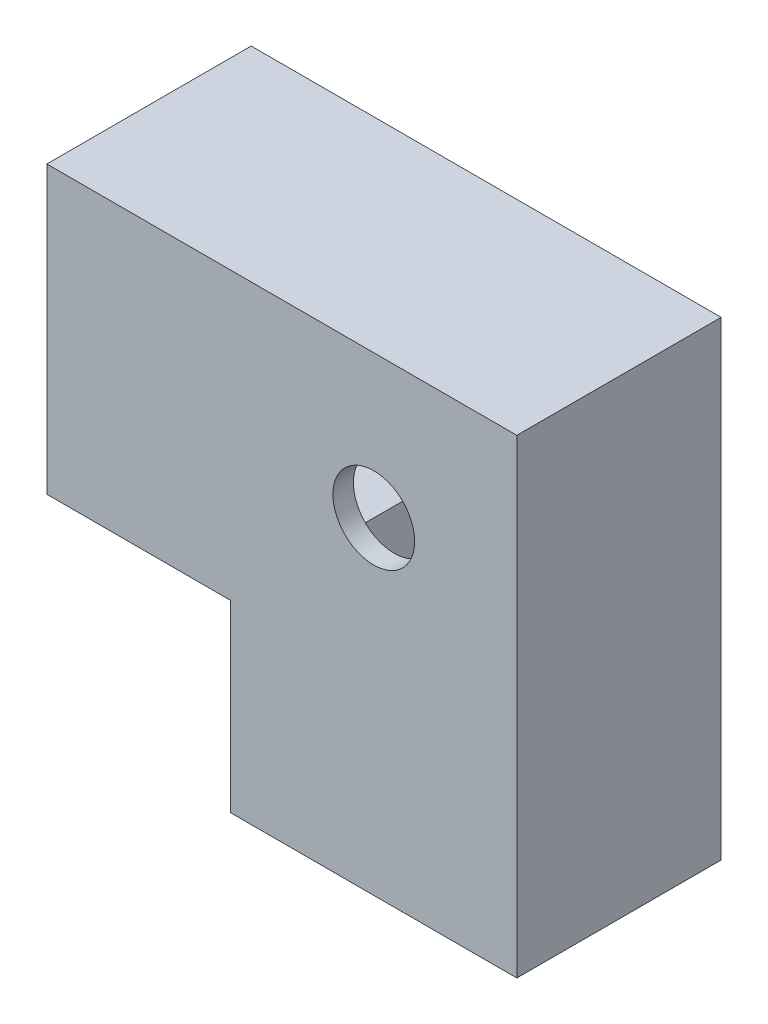
from build123d import *

# Parameters (mm, degrees)
CROQUIS1_R                   = 2000
SALIENTE_EXTRUIR1_DEPTH      = 1000
SALIENTE_EXTRUIR2_DEPTH      = 10000
SALIENTE_EXTRUIR3_DEPTH      = 500
SALIENTE_EXTRUIR3_DEPTH_BACK = 500
SALIENTE_EXTRUIR5_DEPTH      = 500
SALIENTE_EXTRUIR5_DEPTH_BACK = 500


with BuildPart() as part:
    # Croquis1 → Saliente-Extruir1 (new body)
    with BuildSketch(Plane.XY):
        Polygon((117743.416897498, 161337.836627923), (117743.416897498, 152337.836627923), (131743.416897498, 152337.836627923), (131743.416897498, 175337.836627923), (108743.416897498, 175337.836627923), (108743.416897498, 161337.836627923), align=None)
        with Locations((124743.416897498, 168337.836627923)):
            Circle(CROQUIS1_R, mode=Mode.SUBTRACT)
    extrude(amount=-SALIENTE_EXTRUIR1_DEPTH)

    # Croquis1<6> → Saliente-Extruir2 (add)
    with BuildSketch(Plane.XY):
        Polygon((117743.416897498, 161337.836627923), (117743.416897498, 152337.836627923), (118743.416897498, 152337.836627923), (118743.416897498, 162337.836627923), (108743.416897498, 162337.836627923), (108743.416897498, 161337.836627923), align=None)
        with BuildLine():
            Line((130743.416897498, 152337.836627923), (131743.416897498, 152337.836627923))
            Line((131743.416897498, 152337.836627923), (131743.416897498, 175337.836627923))
            Line((131743.416897498, 175337.836627923), (108743.416897498, 175337.836627923))
            Line((108743.416897498, 175337.836627923), (108743.416897498, 174337.836627923))
            Line((108743.416897498, 174337.836627923), (122843.416897498, 174337.836627923))
            Line((122843.416897498, 174337.836627923), (122843.416897498, 172837.836627923))
            ThreePointArc((122843.416897498, 172837.836627923), (123253.467403837, 171847.887134262), (124243.416897498, 171437.836627923))
            Line((124243.416897498, 171437.836627923), (125243.416897498, 171437.836627923))
            ThreePointArc((125243.416897498, 171437.836627923), (126233.366391159, 171847.887134262), (126643.416897498, 172837.836627923))
            Line((126643.416897498, 172837.836627923), (126643.416897498, 174337.836627923))
            Line((126643.416897498, 174337.836627923), (130743.416897498, 174337.836627923))
            Line((130743.416897498, 174337.836627923), (130743.416897498, 170237.836627923))
            Line((130743.416897498, 170237.836627923), (129243.416897498, 170237.836627923))
            ThreePointArc((129243.416897498, 170237.836627923), (128253.467403837, 169827.786121585), (127843.416897498, 168837.836627923))
            Line((127843.416897498, 168837.836627923), (127843.416897498, 167837.836627923))
            ThreePointArc((127843.416897498, 167837.836627923), (128253.467403837, 166847.887134262), (129243.416897498, 166437.836627923))
            Line((129243.416897498, 166437.836627923), (130743.416897498, 166437.836627923))
            Line((130743.416897498, 166437.836627923), (130743.416897498, 152337.836627923))
        make_face()
    extrude(amount=-SALIENTE_EXTRUIR2_DEPTH)

    # Croquis2 → Saliente-Extruir3 (add, two sides: drawn at the far end of the back side and taken through both)
    with BuildSketch(Plane(origin=(0, 156837.836627923, 0), x_dir=(1, 0, 0), z_dir=(0, 1, 0)).offset(-SALIENTE_EXTRUIR3_DEPTH_BACK)):
        with BuildLine():
            add(Edge.make_bspline(
                [(118743.416897498, 8000), (120739.811138244, 7120.578794783), (120743.416897498, 1000)],
                knots=[0, 0, 0, 0.514460755, 0.514460755, 0.514460755], degree=2))
            Line((118743.416897498, 8000), (118743.416897498, 1000))
            Line((118743.416897498, 1000), (120743.416897498, 1000))
        make_face()
        with BuildLine():
            Line((130743.416897498, 1000), (130743.416897498, 8000))
            add(Edge.make_bspline(
                [(130743.416897498, 8000), (128761.675222051, 7234.348262256), (128743.416897498, 1000)],
                knots=[0, 0, 0, 0.590989184, 0.590989184, 0.590989184], degree=2))
            Line((128743.416897498, 1000), (130743.416897498, 1000))
        make_face()
    extrude(amount=SALIENTE_EXTRUIR3_DEPTH + SALIENTE_EXTRUIR3_DEPTH_BACK)

    # Croquis4 → Saliente-Extruir5 (add, two sides: drawn at the far end of the back side and taken through both)
    with BuildSketch(Plane(origin=(113243.416897498, 0, 0), x_dir=(0, 0, -1), z_dir=(1, 0, 0)).offset(-SALIENTE_EXTRUIR5_DEPTH_BACK)):
        with BuildLine():
            Line((8000, 174337.836627923), (0, 174337.836627923))
            Line((0, 174337.836627923), (0, 172337.836627923))
            add(Edge.make_bspline(
                [(8000, 174337.836627923), (6599.854554041, 172118.74354217), (0, 172337.836627923)],
                knots=[0, 0, 0, 0.64837766, 0.64837766, 0.64837766], degree=2))
        make_face()
        with BuildLine():
            add(Edge.make_bspline(
                [(8000, 162337.836627923), (6698.658965378, 164240.824079883), (0, 164337.836627923)],
                knots=[0, 0, 0, 0.707529781, 0.707529781, 0.707529781], degree=2))
            Line((0, 164337.836627923), (0, 162337.836627923))
            Line((0, 162337.836627923), (8000, 162337.836627923))
        make_face()
    extrude(amount=SALIENTE_EXTRUIR5_DEPTH + SALIENTE_EXTRUIR5_DEPTH_BACK)


solid = part.part
